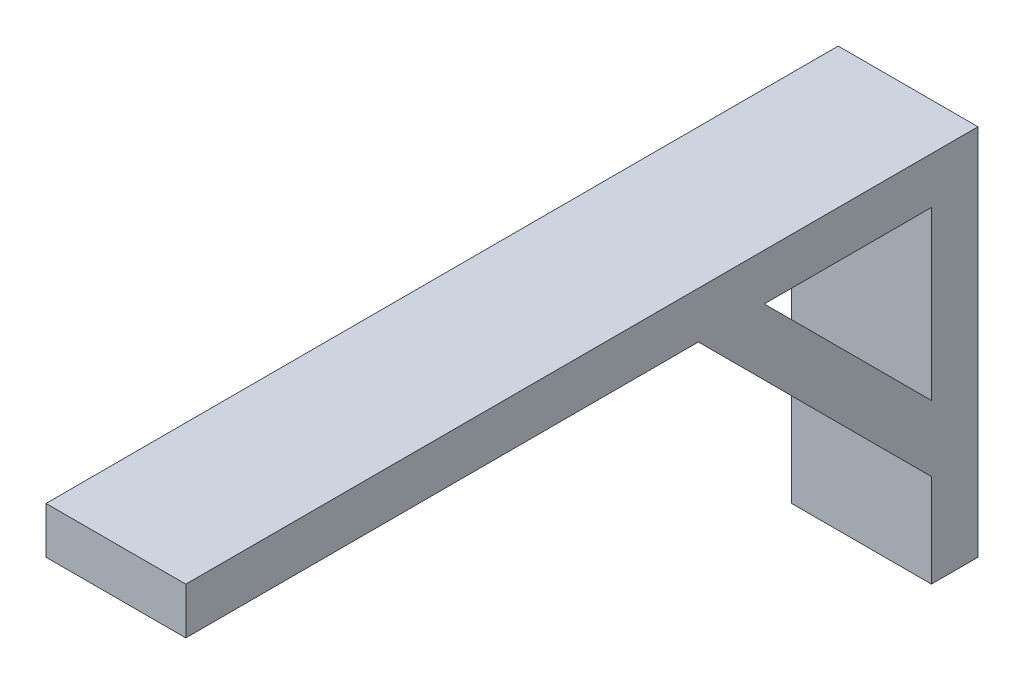
from build123d import *

# Parameters (mm, degrees)
BOSS_EXTRUDE1_DEPTH = 76.2


with BuildPart() as part:
    # Sketch1 → Boss-Extrude1 (new body)
    with BuildSketch(Plane(origin=(0, 0, 0), x_dir=(0, 0, -1), z_dir=(1, 0, 0))):
        Polygon((0, 0), (0, 203.2), (-431.8, 203.2), (-431.8, 177.8), (-152.4, 177.8), (-25.4, 50.8), (-25.4, 0), align=None)
        Polygon((-116.478975516, 177.8), (-25.4, 177.8), (-25.4, 86.721024484), align=None, mode=Mode.SUBTRACT)
    extrude(amount=BOSS_EXTRUDE1_DEPTH)


solid = part.part
